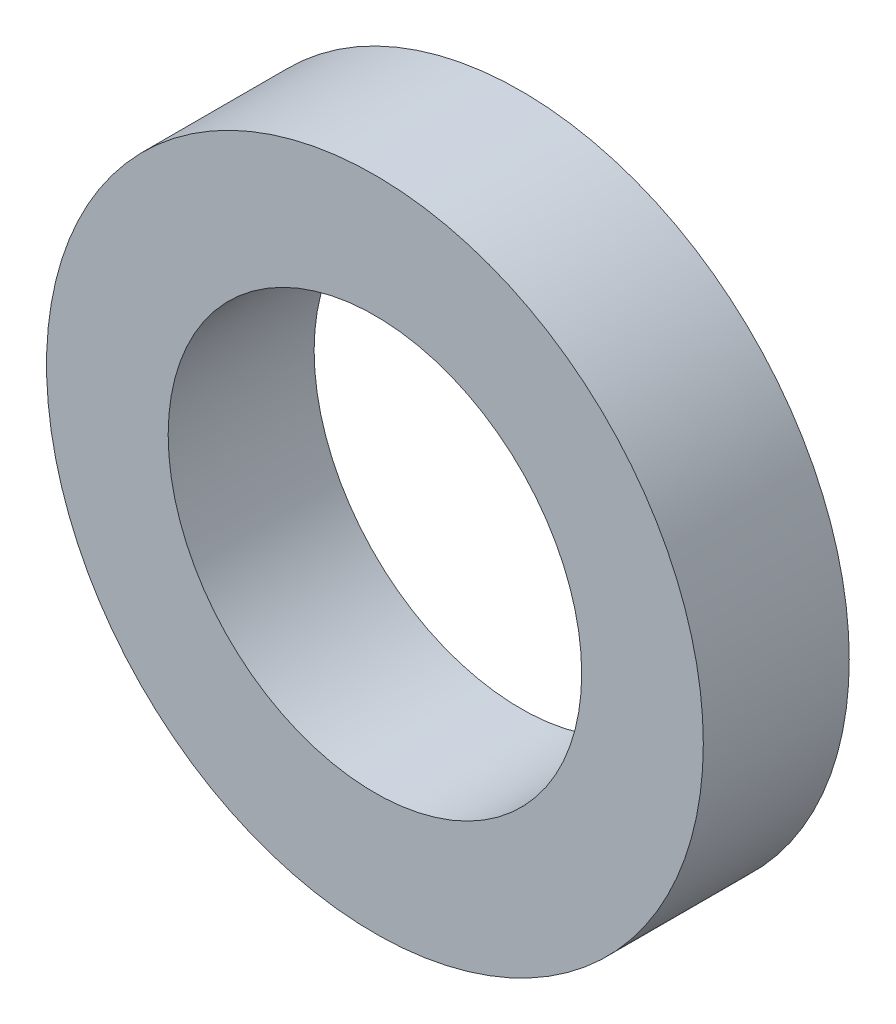
from build123d import *

# Parameters (mm, degrees)
SCHIZZO1_R                   = 6.75
SCHIZZO1_R_2                 = 4.25
ESTRUSIONE_ESTRUSIONE1_DEPTH = 3


with BuildPart() as part:
    # Schizzo1 → Estrusione-Estrusione1 (new body)
    with BuildSketch(Plane.XY):
        Circle(SCHIZZO1_R)
        Circle(SCHIZZO1_R_2, mode=Mode.SUBTRACT)
    extrude(amount=ESTRUSIONE_ESTRUSIONE1_DEPTH)


solid = part.part
